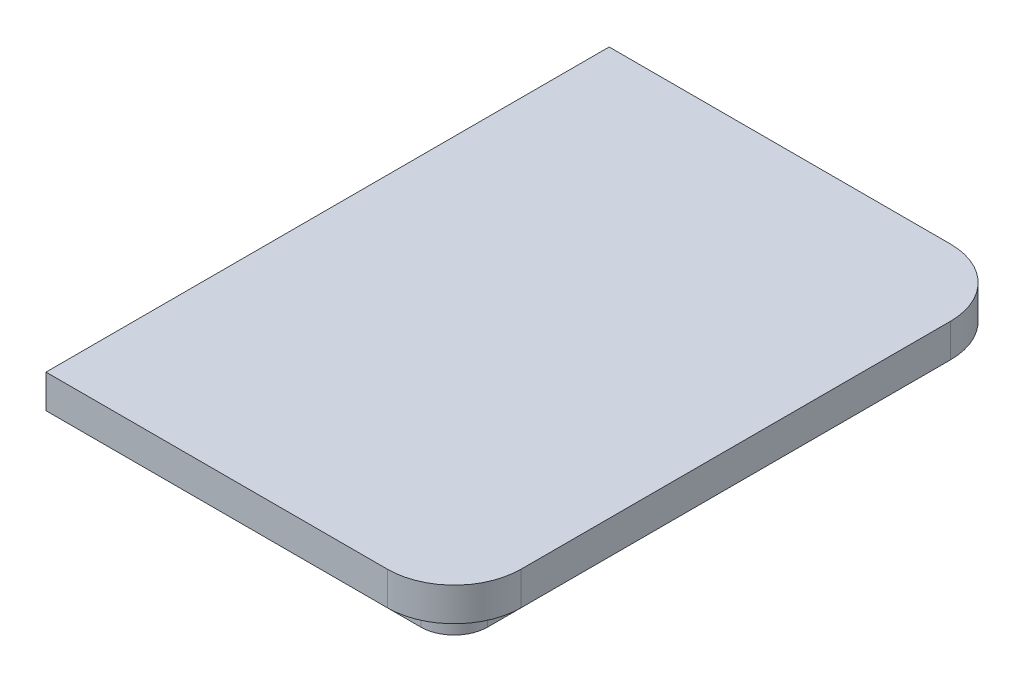
from build123d import *

# Parameters (mm, degrees)
SALIENTE_EXTRUIR1_DEPTH = 5
SALIENTE_EXTRUIR2_DEPTH = 5


with BuildPart() as part:
    # Croquis1 → Saliente-Extruir1 (new body)
    with BuildSketch(Plane(origin=(0, 0, 0), x_dir=(1, 0, 0), z_dir=(0, 1, 0))):
        with BuildLine():
            Line((-30.5, -42.075), (20.5, -42.075))
            ThreePointArc((20.5, -42.075), (27.571067812, -39.146067812), (30.5, -32.075))
            Line((30.5, -32.075), (30.5, 32.075))
            ThreePointArc((30.5, 32.075), (27.571067812, 39.146067812), (20.5, 42.075))
            Line((20.5, 42.075), (-30.5, 42.075))
            Line((-30.5, 42.075), (-30.5, -42.075))
        make_face()
    extrude(amount=SALIENTE_EXTRUIR1_DEPTH)

    # Croquis2 → Saliente-Extruir2 (add)
    with BuildSketch(Plane(origin=(0, 0, 0), x_dir=(1, 0, 0), z_dir=(0, 1, 0))):
        with BuildLine():
            Line((-30.5, -32.075), (20.5, -32.075))
            Line((20.5, -32.075), (20.5, 32.075))
            Line((20.5, 32.075), (-30.5, 32.075))
            Line((-30.5, 32.075), (-30.5, 37.075))
            Line((-30.5, 37.075), (20.5, 37.075))
            ThreePointArc((20.5, 37.075), (24.035533906, 35.610533906), (25.5, 32.075))
            Line((25.5, 32.075), (25.5, -32.075))
            ThreePointArc((25.5, -32.075), (24.035533906, -35.610533906), (20.5, -37.075))
            Line((20.5, -37.075), (-30.5, -37.075))
            Line((-30.5, -37.075), (-30.5, -32.075))
        make_face()
    extrude(amount=-SALIENTE_EXTRUIR2_DEPTH)


solid = part.part
